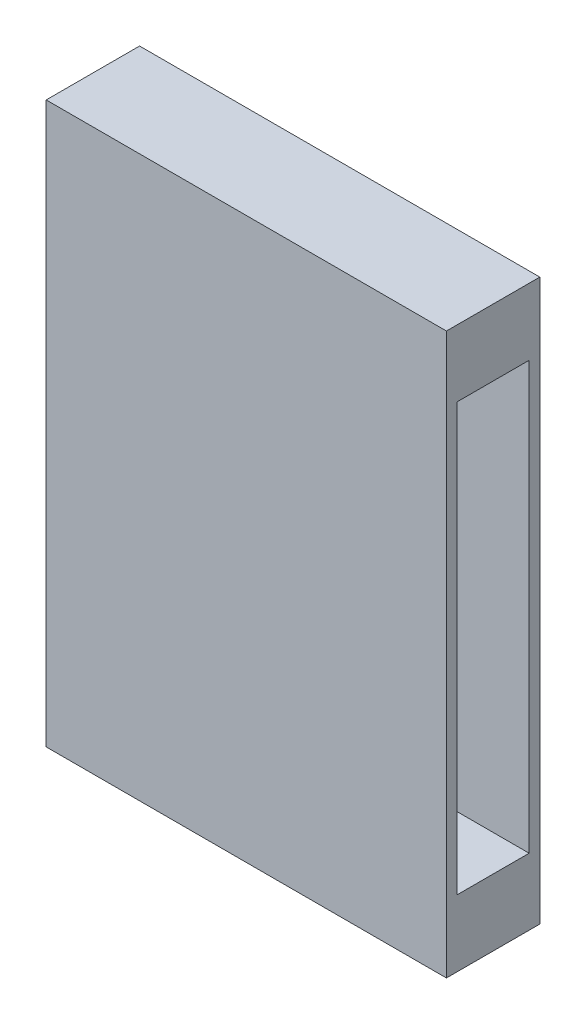
from build123d import *

# Parameters (mm, degrees)
SKETCH1_W           = 30
SKETCH1_H           = 42
BOSS_EXTRUDE1_DEPTH = 7
SKETCH2_W           = 5.4
SKETCH2_H           = 40.4
CUT_EXTRUDE1_DEPTH  = 21
SKETCH3_W           = 5.4
SKETCH3_H           = 32
CUT_EXTRUDE2_DEPTH  = 21


with BuildPart() as part:
    # Sketch1 → Boss-Extrude1 (new body)
    with BuildSketch(Plane.XY):
        with Locations((15, 21)):
            Rectangle(SKETCH1_W, SKETCH1_H)
    extrude(amount=BOSS_EXTRUDE1_DEPTH)

    # Sketch2 → Cut-Extrude1 (cut)
    with BuildSketch(Plane.ZY):
        with Locations((3.5, 21)):
            Rectangle(SKETCH2_W, SKETCH2_H)
    extrude(amount=-CUT_EXTRUDE1_DEPTH, mode=Mode.SUBTRACT)

    # Sketch3 → Cut-Extrude2 (cut)
    with BuildSketch(Plane(origin=(30, 0, 0), x_dir=(0, 0, -1), z_dir=(1, 0, 0))):
        with Locations((-3.5, 21)):
            Rectangle(SKETCH3_W, SKETCH3_H)
    extrude(amount=-CUT_EXTRUDE2_DEPTH, mode=Mode.SUBTRACT)


solid = part.part
